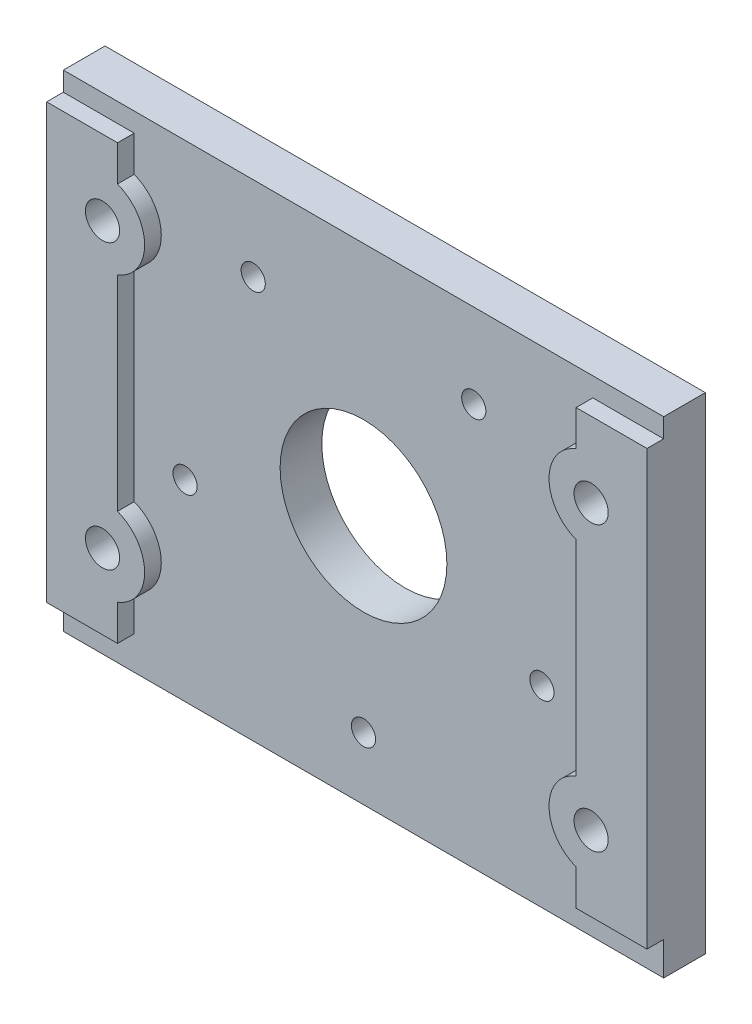
from build123d import *

# Parameters (mm, degrees)
SKETCH1_W           = 72
SKETCH1_H           = 58.3
SKETCH1_R           = 10
SKETCH1_R_2         = 1.45
BOSS_EXTRUDE1_DEPTH = 5
SKETCH2_W           = 8.5
SKETCH2_H           = 52
BOSS_EXTRUDE2_DEPTH = 7
SKETCH3_R           = 5.05
BOSS_EXTRUDE3_DEPTH = 7
SKETCH4_R           = 5.05
BOSS_EXTRUDE4_DEPTH = 7
SKETCH5_R           = 2.05
CUT_EXTRUDE1_DEPTH  = 6.7
SKETCH6_W           = 8.5
SKETCH6_H           = 52
BOSS_EXTRUDE5_DEPTH = 7
SKETCH7_R           = 5.05
BOSS_EXTRUDE6_DEPTH = 7
SKETCH8_R           = 5.05
BOSS_EXTRUDE7_DEPTH = 7
SKETCH9_R           = 2.05
CUT_EXTRUDE2_DEPTH  = 6.7


with BuildPart() as part:
    # Sketch1 → Boss-Extrude1 (new body)
    with BuildSketch(Plane.XY.offset(280)):
        with Locations((300, 299.15)):
            Rectangle(SKETCH1_W, SKETCH1_H)
        with Locations((300, 300)):
            Circle(SKETCH1_R, mode=Mode.SUBTRACT)
        with Locations((286.774831823, 318.202882373)):
            Circle(SKETCH1_R_2, mode=Mode.SUBTRACT)
        with Locations((278.601228383, 293.047117627)):
            Circle(SKETCH1_R_2, mode=Mode.SUBTRACT)
        with Locations((300, 277.5)):
            Circle(SKETCH1_R_2, mode=Mode.SUBTRACT)
        with Locations((321.398771617, 293.047117627)):
            Circle(SKETCH1_R_2, mode=Mode.SUBTRACT)
        with Locations((313.225168177, 318.202882373)):
            Circle(SKETCH1_R_2, mode=Mode.SUBTRACT)
    extrude(amount=BOSS_EXTRUDE1_DEPTH)

    # Sketch2 → Boss-Extrude2 (add)
    with BuildSketch(Plane.XY.offset(280)):
        with Locations((268.25, 300)):
            Rectangle(SKETCH2_W, SKETCH2_H)
    extrude(amount=BOSS_EXTRUDE2_DEPTH)

    # Sketch3 → Boss-Extrude3 (add)
    with BuildSketch(Plane.XY.offset(280)):
        with Locations((270.7, 283)):
            Circle(SKETCH3_R)
    extrude(amount=BOSS_EXTRUDE3_DEPTH)

    # Sketch4 → Boss-Extrude4 (add)
    with BuildSketch(Plane.XY.offset(280)):
        with Locations((270.7, 317)):
            Circle(SKETCH4_R)
    extrude(amount=BOSS_EXTRUDE4_DEPTH)

    # Sketch5 → Cut-Extrude1 (cut)
    with BuildSketch(Plane.XY.offset(280.3)):
        with Locations((270.7, 283)):
            Circle(SKETCH5_R)
        with Locations((270.7, 317)):
            Circle(SKETCH5_R)
    extrude(amount=CUT_EXTRUDE1_DEPTH, mode=Mode.SUBTRACT)

    # Sketch6 → Boss-Extrude5 (add)
    with BuildSketch(Plane.XY.offset(280)):
        with Locations((331.75, 300)):
            Rectangle(SKETCH6_W, SKETCH6_H)
    extrude(amount=BOSS_EXTRUDE5_DEPTH)

    # Sketch7 → Boss-Extrude6 (add)
    with BuildSketch(Plane.XY.offset(280)):
        with Locations((329.3, 283)):
            Circle(SKETCH7_R)
    extrude(amount=BOSS_EXTRUDE6_DEPTH)

    # Sketch8 → Boss-Extrude7 (add)
    with BuildSketch(Plane.XY.offset(280)):
        with Locations((329.3, 317)):
            Circle(SKETCH8_R)
    extrude(amount=BOSS_EXTRUDE7_DEPTH)

    # Sketch9 → Cut-Extrude2 (cut)
    with BuildSketch(Plane.XY.offset(280.3)):
        with Locations((329.3, 283)):
            Circle(SKETCH9_R)
        with Locations((329.3, 317)):
            Circle(SKETCH9_R)
    extrude(amount=CUT_EXTRUDE2_DEPTH, mode=Mode.SUBTRACT)


solid = part.part
